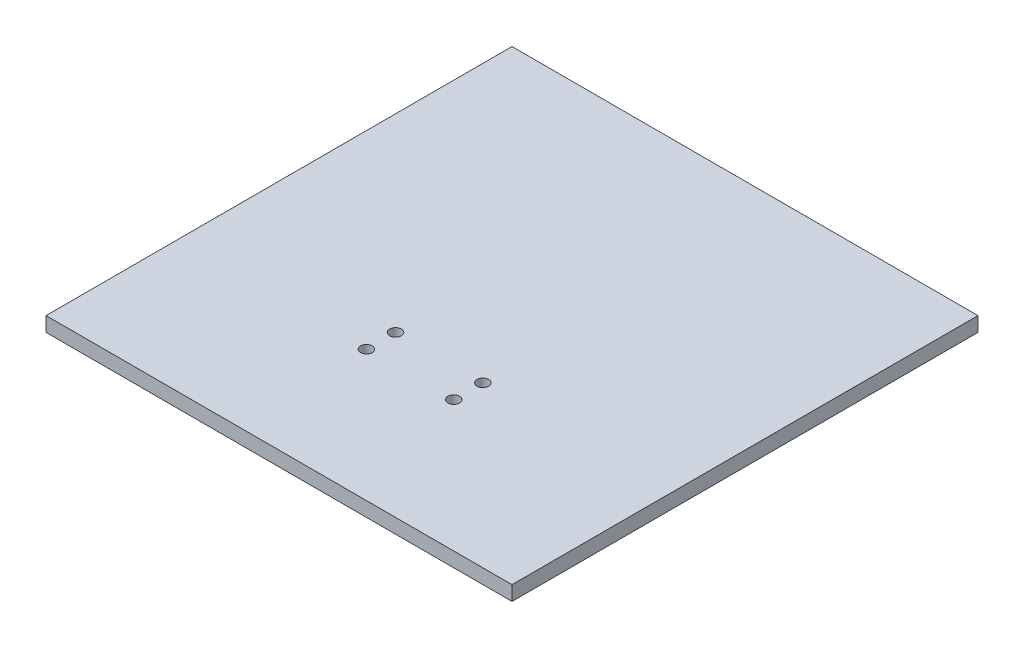
from build123d import *

# Parameters (mm, degrees)
SKETCH2_W                                          = 203.2
SKETCH2_H                                          = 203.2
BOSS_EXTRUDE2_DEPTH                                = 6.35
CSK_FOR_10_FLAT_HEAD_MACHINE_SCREW_100_D           = 5.1054
CSK_FOR_10_FLAT_HEAD_MACHINE_SCREW_100_CSINK_D     = 9.779
CSK_FOR_10_FLAT_HEAD_MACHINE_SCREW_100_CSINK_ANGLE = 100


with BuildPart() as part:
    # Sketch2 → Boss-Extrude2 (new body)
    with BuildSketch(Plane(origin=(0, 0, 0), x_dir=(1, 0, 0), z_dir=(0, 1, 0))):
        with Locations((101.6, 101.6)):
            Rectangle(SKETCH2_W, SKETCH2_H)
    extrude(amount=BOSS_EXTRUDE2_DEPTH)

    # CSK for #10 Flat Head Machine Screw (100)1 (through all)
    with Locations(Plane(origin=(0, 0, 0), x_dir=(-1, 0, 0), z_dir=(0, -1, 0))):
        with Locations((-82.55, 57.15), (-82.55, 69.85), (-120.65, 57.15), (-120.65, 69.85)):
            CounterSinkHole(CSK_FOR_10_FLAT_HEAD_MACHINE_SCREW_100_D / 2, CSK_FOR_10_FLAT_HEAD_MACHINE_SCREW_100_CSINK_D / 2, counter_sink_angle=CSK_FOR_10_FLAT_HEAD_MACHINE_SCREW_100_CSINK_ANGLE)


solid = part.part
